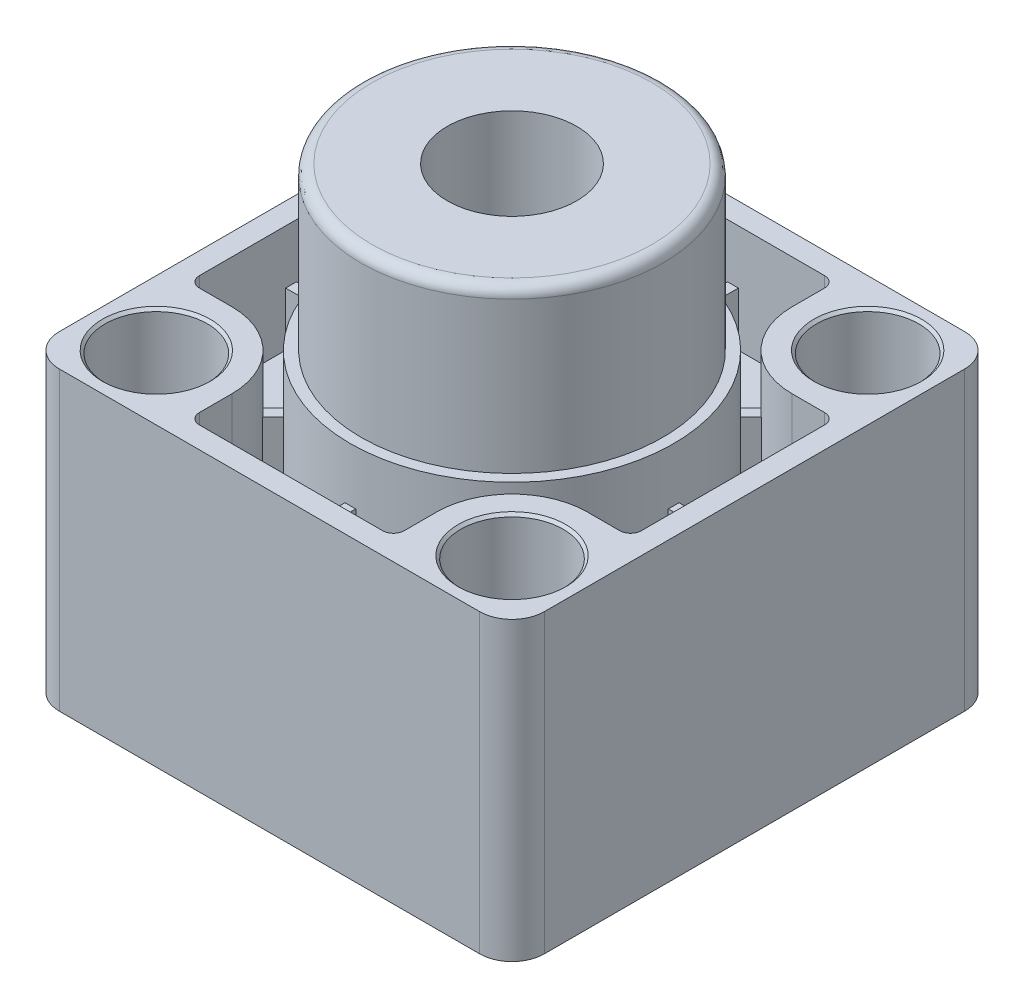
from build123d import *

# Parameters (mm, degrees)
BOSS_EXTRUDE1_DEPTH                          = 27.5
CBORE_FOR_M6_HEX_SOCKET_HEAD_CAP_SCR_2_COUNT = 2
CBORE_FOR_M6_HEX_SOCKET_HEAD_CAP_SCR_2_PITCH = 33
CBORE_FOR_M6_HEX_SOCKET_HEAD_CAP_SCR_3_COUNT = 2
CBORE_FOR_M6_HEX_SOCKET_HEAD_CAP_SCR_3_PITCH = 46.669047558
CBORE_FOR_M6_HEX_SOCKET_HEAD_CAP_SCR_4_COUNT = 2
CBORE_FOR_M6_HEX_SOCKET_HEAD_CAP_SCR_4_PITCH = 33
SKETCH8_R                                    = 15
CUT_EXTRUDE3_DEPTH                           = 10
SKETCH9_W                                    = 1
SKETCH9_H                                    = 7.727187909
SKETCH9_W_2                                  = 7.727187909
SKETCH9_H_2                                  = 1
EXTRUDE_THIN3_DEPTH                          = 5
FILLET1_R                                    = 1
SKETCH10_R                                   = 14
BOSS_EXTRUDE2_DEPTH                          = 15
FILLET2_R                                    = 1
SKETCH11_R                                   = 6
CUT_EXTRUDE4_DEPTH                           = 54.091901454
SKETCH12_R                                   = 16
SKETCH12_R_2                                 = 6
BOSS_EXTRUDE3_DEPTH                          = 5
SKETCH14_R                                   = 3.175
CUT_EXTRUDE6_DEPTH                           = 10
CHAMFER2_SIZE                                = 0.5


with BuildPart() as part:
    # Sketch1 → Boss-Extrude1 (new body)
    with BuildSketch(Plane(origin=(0, 0, 0), x_dir=(1, 0, 0), z_dir=(0, 1, 0))):
        with BuildLine():
            Line((-19.5, -22.5), (19.5, -22.5))
            ThreePointArc((19.5, -22.5), (21.621320344, -21.621320344), (22.5, -19.5))
            Line((22.5, -19.5), (22.5, 19.5))
            ThreePointArc((22.5, 19.5), (21.621320344, 21.621320344), (19.5, 22.5))
            Line((19.5, 22.5), (-19.5, 22.5))
            ThreePointArc((-19.5, 22.5), (-21.621320344, 21.621320344), (-22.5, 19.5))
            Line((-22.5, 19.5), (-22.5, -19.5))
            ThreePointArc((-22.5, -19.5), (-21.621320344, -21.621320344), (-19.5, -22.5))
        make_face()
    extrude(amount=BOSS_EXTRUDE1_DEPTH)

    # Sketch3 → CBORE for M6 Hex Socket Head Cap Screw1 (revolve, cut)
    with BuildSketch(Plane(origin=(-16.5, 27.5, -16.5), x_dir=(0, 0, 1), z_dir=(1, 0, 0))):
        Polygon((0, 0), (0, 27.5), (3.2, 27.5), (3.2, 15), (4.75, 15), (4.75, 0.25), (5, 0), align=None)
    cbore_for_m6_hex_socket_head_cap_screw1 = revolve(axis=Axis((-16.5, 33.85, -16.5), (0, -1, 0)), mode=Mode.SUBTRACT)

    # CBORE for M6 Hex Socket Head Cap Scr 2: CBORE for M6 Hex Socket Head Cap Screw1 ×2
    with Locations(*[(i * CBORE_FOR_M6_HEX_SOCKET_HEAD_CAP_SCR_2_PITCH, 0, 0) for i in range(1, CBORE_FOR_M6_HEX_SOCKET_HEAD_CAP_SCR_2_COUNT)]):
        add(cbore_for_m6_hex_socket_head_cap_screw1, mode=Mode.SUBTRACT)

    # CBORE for M6 Hex Socket Head Cap Scr 3: CBORE for M6 Hex Socket Head Cap Screw1 ×2
    with Locations(*[Vector(0.7071067811865476, 0, 0.7071067811865475) * (i * CBORE_FOR_M6_HEX_SOCKET_HEAD_CAP_SCR_3_PITCH) for i in range(1, CBORE_FOR_M6_HEX_SOCKET_HEAD_CAP_SCR_3_COUNT)]):
        add(cbore_for_m6_hex_socket_head_cap_screw1, mode=Mode.SUBTRACT)

    # CBORE for M6 Hex Socket Head Cap Scr 4: CBORE for M6 Hex Socket Head Cap Screw1 ×2
    with Locations(*[(0, 0, i * CBORE_FOR_M6_HEX_SOCKET_HEAD_CAP_SCR_4_PITCH) for i in range(1, CBORE_FOR_M6_HEX_SOCKET_HEAD_CAP_SCR_4_COUNT)]):
        add(cbore_for_m6_hex_socket_head_cap_screw1, mode=Mode.SUBTRACT)

    # Sketch8 → Cut-Extrude3 (cut)
    with BuildSketch(Plane(origin=(0, 27.5, 0), x_dir=(1, 0, 0), z_dir=(0, 1, 0))):
        with BuildLine():
            ThreePointArc((-9.5, -16.5), (-11.550252532, -11.550252532), (-16.5, -9.5))
            Line((-16.5, -9.5), (-20.5, -9.5))
            Line((-20.5, -9.5), (-20.5, 0))
            Line((-20.5, 0), (-20.5, 9.5))
            Line((-20.5, 9.5), (-16.5, 9.5))
            ThreePointArc((-16.5, 9.5), (-11.550252532, 11.550252532), (-9.5, 16.5))
            Line((-9.5, 16.5), (-9.5, 20.5))
            Line((-9.5, 20.5), (0, 20.5))
            Line((0, 20.5), (9.5, 20.5))
            Line((9.5, 20.5), (9.5, 16.5))
            ThreePointArc((9.5, 16.5), (11.550252532, 11.550252532), (16.5, 9.5))
            Line((16.5, 9.5), (20.5, 9.5))
            Line((20.5, 9.5), (20.5, 0))
            Line((20.5, 0), (20.5, -9.5))
            Line((20.5, -9.5), (16.5, -9.5))
            ThreePointArc((16.5, -9.5), (11.550252532, -11.550252532), (9.5, -16.5))
            Line((9.5, -16.5), (9.5, -20.5))
            Line((9.5, -20.5), (0, -20.5))
            Line((0, -20.5), (-9.5, -20.5))
            Line((-9.5, -20.5), (-9.5, -16.5))
        make_face()
        with Locations(Location((0, 0, 0), (0, 0, 270))):
            Circle(SKETCH8_R, mode=Mode.SUBTRACT)
    extrude(amount=-CUT_EXTRUDE3_DEPTH, mode=Mode.SUBTRACT)

    # Sketch9 → Extrude-Thin3 (add)
    with BuildSketch(Plane(origin=(0, 17.5, 0), x_dir=(1, 0, 0), z_dir=(0, 1, 0))):
        with Locations((0, 17.395249071)):
            Rectangle(SKETCH9_W, SKETCH9_H)
        Polygon((-9.522770805, 10.229877587), (-11.660876198, 12.367982979), (-12.367982979, 11.660876198), (-10.229877587, 9.522770805), align=None)
        with Locations((17.395249071, 0)):
            Rectangle(SKETCH9_W_2, SKETCH9_H_2)
        Polygon((10.229877587, 9.522770805), (12.367982979, 11.660876198), (11.660876198, 12.367982979), (9.522770805, 10.229877587), align=None)
        with Locations((0, -17.395249071)):
            Rectangle(SKETCH9_W, SKETCH9_H)
        Polygon((9.522770805, -10.229877587), (11.660876198, -12.367982979), (12.367982979, -11.660876198), (10.229877587, -9.522770805), align=None)
        with Locations((-17.395249071, 0)):
            Rectangle(SKETCH9_W_2, SKETCH9_H_2)
        Polygon((-10.229877587, -9.522770805), (-12.367982979, -11.660876198), (-11.660876198, -12.367982979), (-9.522770805, -10.229877587), align=None)
    extrude(amount=EXTRUDE_THIN3_DEPTH)

    # Fillet1
    fillet1_edges = [part.edges().sort_by_distance(p)[0] for p in [
        (-20.5, 22.5, 9.5),
        (-20.5, 22.5, -9.5),
        (-9.5, 22.5, -20.5),
        (9.5, 22.5, -20.5),
        (20.5, 22.5, -9.5),
        (20.5, 22.5, 9.5),
        (9.5, 22.5, 20.5),
        (-9.5, 22.5, 20.5),
    ]]
    fillet(fillet1_edges, radius=FILLET1_R)

    # Sketch10 → Boss-Extrude2 (add)
    with BuildSketch(Plane(origin=(0, 27.5, 0), x_dir=(1, 0, 0), z_dir=(0, 1, 0))):
        with Locations(Location((0, 0, 0), (0, 0, 270))):
            Circle(SKETCH10_R)
    extrude(amount=BOSS_EXTRUDE2_DEPTH)

    # Fillet2
    fillet2_edges = [part.edges().sort_by_distance(p)[0] for p in [
        (0, 42.5, -14),
    ]]
    fillet(fillet2_edges, radius=FILLET2_R)

    # Sketch11 → Cut-Extrude4 (cut, through all)
    with BuildSketch(Plane(origin=(0, 42.5, 0), x_dir=(1, 0, 0), z_dir=(0, 1, 0))):
        with Locations(Location((0, 0, 0), (0, 0, 270))):
            Circle(SKETCH11_R)
    extrude(amount=-CUT_EXTRUDE4_DEPTH, mode=Mode.SUBTRACT)

    # Sketch12 → Boss-Extrude3 (add)
    with BuildSketch(Plane.XZ):
        with Locations(Location((0, 0, 0), (0, 0, 270))):
            Circle(SKETCH12_R)
        with Locations(Location((0, 0, 0), (0, 0, 90))):
            Circle(SKETCH12_R_2, mode=Mode.SUBTRACT)
    extrude(amount=BOSS_EXTRUDE3_DEPTH)

    # Sketch14 → Cut-Extrude6 (cut)
    with BuildSketch(Plane(origin=(0, 0, -22.5), x_dir=(-1, 0, 0), z_dir=(0, 0, -1))):
        with Locations((-5.5, 13.75)):
            Circle(SKETCH14_R)
    extrude(amount=-CUT_EXTRUDE6_DEPTH, mode=Mode.SUBTRACT)

    # Chamfer2
    chamfer2_edges = [part.edges().sort_by_distance(p)[0] for p in [
        (8.675, 13.75, -22.5),
    ]]
    chamfer(chamfer2_edges, length=CHAMFER2_SIZE)


solid = part.part
